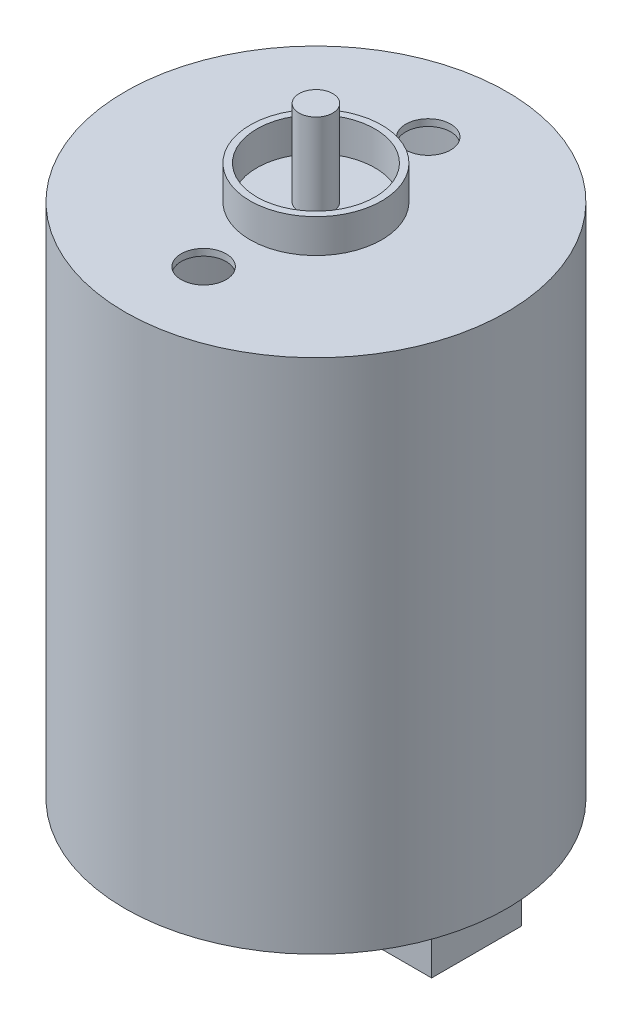
from build123d import *

# Parameters (mm, degrees)
SKETCH1_R           = 8.5
BOSS_EXTRUDE1_DEPTH = 23
SHELL3_T            = -0.3
SKETCH2_R           = 8.2
BOSS_EXTRUDE2_DEPTH = 0.3
SKETCH3_R           = 1.15
BOSS_EXTRUDE3_DEPTH = 1.5
SKETCH4_R           = 2.929639603
SKETCH4_R_2         = 2.629639603
BOSS_EXTRUDE4_DEPTH = 1.5
SKETCH5_R           = 0.75
BOSS_EXTRUDE5_DEPTH = 3.8
CUT_EXTRUDE1_REACH  = 28.842
SKETCH7_R           = 1
SKETCH8_W           = 2.3
SKETCH8_H           = 4
BOSS_EXTRUDE7_DEPTH = 2.85


with BuildPart() as part:
    # Sketch1 → Boss-Extrude1 (new body)
    with BuildSketch(Plane(origin=(0, 0, 0), x_dir=(1, 0, 0), z_dir=(0, 1, 0))):
        with Locations(Location((0, 0, 0), (0, 0, 270))):
            Circle(SKETCH1_R)
    extrude(amount=BOSS_EXTRUDE1_DEPTH)

    # Shell3
    shell3_openings = [part.faces().sort_by_distance(p)[0] for p in [
        (0, 0, 0),
    ]]
    offset(amount=SHELL3_T, openings=shell3_openings, kind=Kind.INTERSECTION)

    # Sketch2 → Boss-Extrude2 (add)
    with BuildSketch(Plane(origin=(0, 0.5, 0), x_dir=(-1, 0, 0), z_dir=(0, -1, 0))):
        with Locations(Location((0, 0, 0), (0, 0, 90))):
            Circle(SKETCH2_R)
    extrude(amount=-BOSS_EXTRUDE2_DEPTH)

    # Sketch3 → Boss-Extrude3 (add)
    with BuildSketch(Plane.XZ.offset(-0.5)):
        with Locations(Location((0, 0, 0), (0, 0, 270))):
            Circle(SKETCH3_R)
    extrude(amount=BOSS_EXTRUDE3_DEPTH)

    # Sketch4 → Boss-Extrude4 (add)
    with BuildSketch(Plane(origin=(0, 23, 0), x_dir=(1, 0, 0), z_dir=(0, 1, 0))):
        with Locations(Location((0, 0, 0), (0, 0, 270))):
            Circle(SKETCH4_R)
        with Locations(Location((0, 0, 0), (0, 0, 270))):
            Circle(SKETCH4_R_2, mode=Mode.SUBTRACT)
    extrude(amount=BOSS_EXTRUDE4_DEPTH)

    # Sketch5 → Boss-Extrude5 (add)
    with BuildSketch(Plane(origin=(0, 23, 0), x_dir=(1, 0, 0), z_dir=(0, 1, 0))):
        with Locations(Location((0, 0, 0), (0, 0, 90))):
            Circle(SKETCH5_R)
    extrude(amount=BOSS_EXTRUDE5_DEPTH)

    # Sketch7 → Cut-Extrude1 (cut, up to next)
    with BuildSketch(Plane(origin=(0, 23, 0), x_dir=(1, 0, 0), z_dir=(0, 1, 0)), mode=Mode.PRIVATE) as cut_extrude1_sk1:
        with Locations(Location((0, 5, 0), (0, 0, 270))):
            Circle(SKETCH7_R)
    cut_extrude1_tool1 = extrude(cut_extrude1_sk1.sketch, amount=-CUT_EXTRUDE1_REACH, mode=Mode.PRIVATE) & part.part
    # Sketch7 → Cut-Extrude1 (cut, up to next)
    with BuildSketch(Plane(origin=(0, 23, 0), x_dir=(1, 0, 0), z_dir=(0, 1, 0)), mode=Mode.PRIVATE) as cut_extrude1_sk2:
        with Locations(Location((0, -5, 0), (0, 0, 270))):
            Circle(SKETCH7_R)
    cut_extrude1_tool2 = extrude(cut_extrude1_sk2.sketch, amount=-CUT_EXTRUDE1_REACH, mode=Mode.PRIVATE) & part.part
    add(cut_extrude1_tool1.solids().sort_by_distance((0, 23, -5))[0], mode=Mode.SUBTRACT)
    add(cut_extrude1_tool2.solids().sort_by_distance((0, 23, 5))[0], mode=Mode.SUBTRACT)

    # Sketch8 → Boss-Extrude7 (add)
    with BuildSketch(Plane.XZ.offset(-0.5)):
        with Locations((-6, 0)):
            Rectangle(SKETCH8_W, SKETCH8_H)
        with Locations((6, 0)):
            Rectangle(SKETCH8_W, SKETCH8_H)
    extrude(amount=BOSS_EXTRUDE7_DEPTH)


solid = part.part
